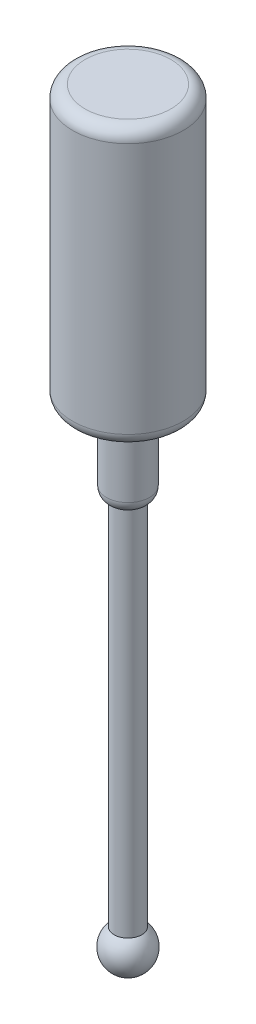
from build123d import *

# Parameters (mm, degrees)
SZKIC2_R                    = 5
DODANIE_WYCI_GNI_CIE1_DEPTH = 270


with BuildPart() as part:
    # Szkic1 → Obrót1 (revolve)
    with BuildSketch(Plane.XY):
        with BuildLine():
            Line((0, 8), (0, -8))
            ThreePointArc((0, -8), (8, 0), (0, 8))
        make_face()
    revolve(axis=Axis((0, 8, 0), (0, -1, 0)))

    # Szkic2 → Dodanie-wyciągnięcie1 (add)
    with BuildSketch(Plane(origin=(0, 0, 0), x_dir=(1, 0, 0), z_dir=(0, 1, 0))):
        with Locations(Location((0, 0, 0), (0, 0, 90))):
            Circle(SZKIC2_R)
    extrude(amount=DODANIE_WYCI_GNI_CIE1_DEPTH)

    # Szkic3 → Obrót2 (revolve)
    with BuildSketch(Plane.XY):
        with BuildLine():
            Line((0, 270), (-15.5, 270))
            ThreePointArc((-15.5, 270), (-18.681980515, 268.681980515), (-20, 265.5))
            Line((-20, 265.5), (-20, 174.5))
            ThreePointArc((-20, 174.5), (-18.681980515, 171.318019485), (-15.5, 170))
            Line((-15.5, 170), (-12.25, 170))
            ThreePointArc((-12.25, 170), (-9.068019485, 168.681980515), (-7.75, 165.5))
            Line((-7.75, 165.5), (-7.75, 144.5))
            ThreePointArc((-7.75, 144.5), (-6.431980515, 141.318019485), (-3.25, 140))
            Line((-3.25, 140), (0, 140))
            Line((0, 140), (0, 270))
        make_face()
    revolve(axis=Axis((0, 270, 0), (0, -1, 0)))


solid = part.part
